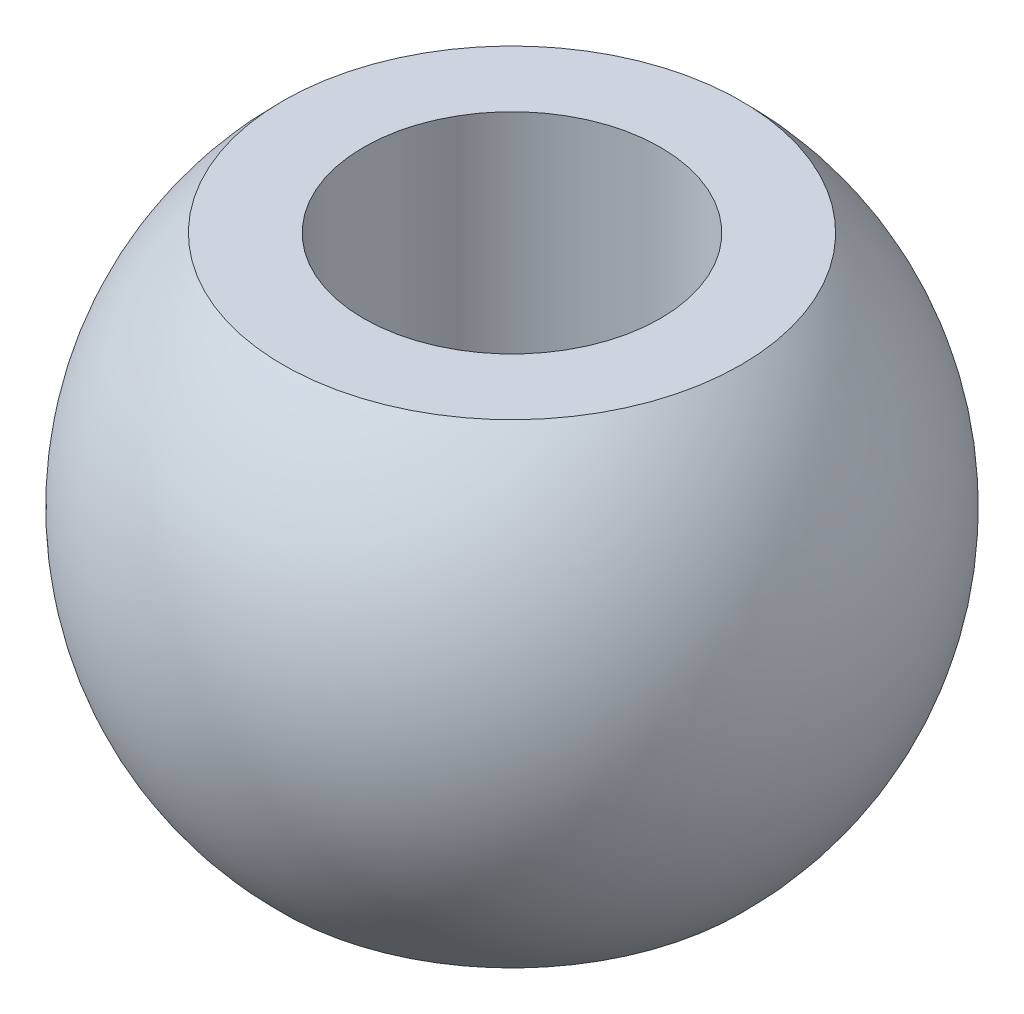
from build123d import *


with BuildPart() as part:
    # Sketch1 → Revolve1 (revolve)
    with BuildSketch(Plane.XY, mode=Mode.PRIVATE) as revolve1_sk:
        with BuildLine():
            Line((2.5, 4), (2.5, -4))
            Line((2.5, -4), (3.856051867, -4))
            ThreePointArc((3.856051867, -4), (5.556, 0), (3.856051867, 4))
            Line((3.856051867, 4), (2.5, 4))
        make_face()
    revolve(revolve1_sk.sketch.rotate(Axis((0, 6.850019796, 0), (0, -1, 0)), 90), axis=Axis((0, 6.850019796, 0), (0, -1, 0)))


solid = part.part
